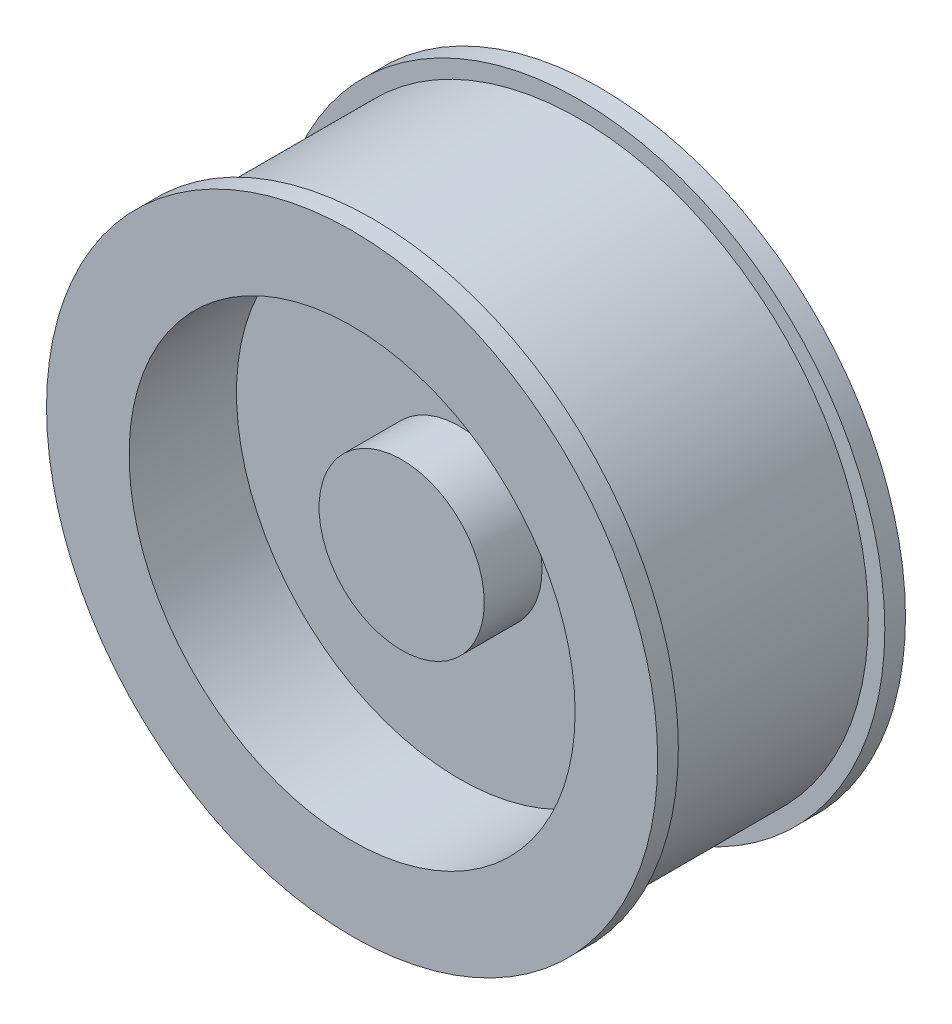
from build123d import *


with BuildPart() as part:
    # Croquis2 → Revolución2 (revolve)
    with BuildSketch(Plane(origin=(0, 0, 0), x_dir=(0, 0, -1), z_dir=(1, 0, 0)), mode=Mode.PRIVATE) as revoluci_n2_sk:
        Polygon((-30, -86), (-30, -90), (-25, -90), (-25, -86), (-4, -86), (4, -86), (25, -86), (25, -90), (30, -90), (30, -86), (30, -70), (4, -70), (4, -36), (18, -36), (18, -16), (-18, -16), (-18, -36), (-4, -36), (-4, -70), (-30, -70), align=None)
    revolve(revoluci_n2_sk.sketch.rotate(Axis((0, -16, -14.613309118), (0, 0, -1)), 270), axis=Axis((0, -16, -14.613309118), (0, 0, -1)))


solid = part.part
